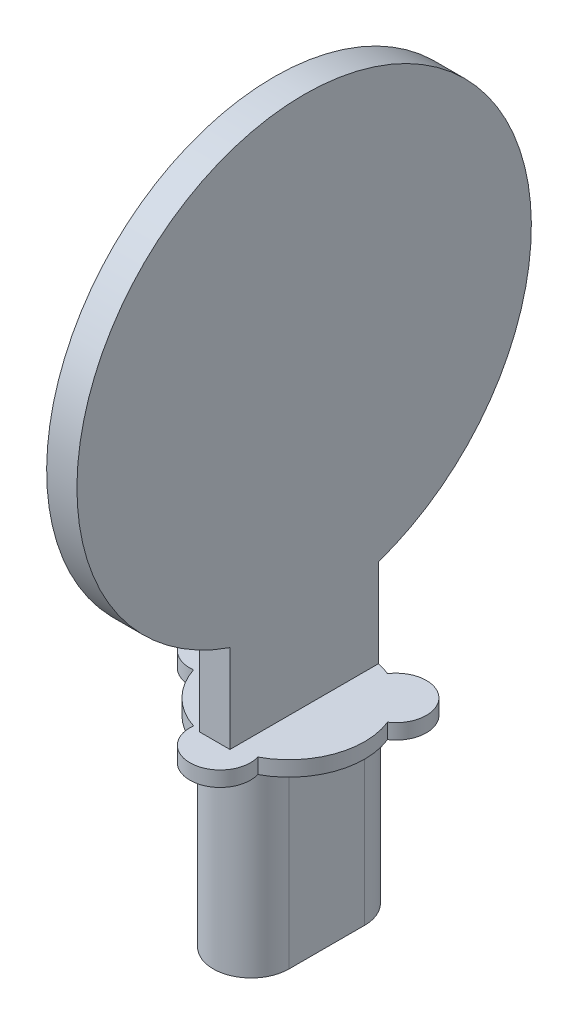
from build123d import *

# Parameters (mm, degrees)
BOSS_EXTRUDE1_DEPTH = 13
BOSS_EXTRUDE2_DEPTH = 1
SKETCH1_5_W         = 2
SKETCH1_5_H         = 9.797958972
BOSS_EXTRUDE3_DEPTH = 20
SKETCH2_R           = 15
BOSS_EXTRUDE4_DEPTH = 2


with BuildPart() as part:
    # Sketch1 → Boss-Extrude1 (new body)
    with BuildSketch(Plane(origin=(0, 0, 0), x_dir=(1, 0, 0), z_dir=(0, 1, 0))):
        with BuildLine():
            Line((2.5, 2.5), (2.5, -2.5))
            ThreePointArc((2.5, -2.5), (0, -5), (-2.5, -2.5))
            Line((-2.5, -2.5), (-2.5, 2.5))
            ThreePointArc((-2.5, 2.5), (0, 5), (2.5, 2.5))
        make_face()
    extrude(amount=-BOSS_EXTRUDE1_DEPTH)

    # Sketch1<3> → Boss-Extrude2 (add)
    with BuildSketch(Plane(origin=(0, 0, 0), x_dir=(1, 0, 0), z_dir=(0, 1, 0))):
        with BuildLine():
            ThreePointArc((1.867050547, 4.63833184), (-1.710100717, 4.698463104), (-4.411705933, 2.353051372))
            ThreePointArc((-4.411705933, 2.353051372), (-6.973362887, 0.610090199), (-4.75328529, -1.551218539))
            ThreePointArc((-4.75328529, -1.551218539), (-3.535533906, -3.535533906), (-1.551218539, -4.75328529))
            ThreePointArc((-1.551218539, -4.75328529), (0.610090199, -6.973362887), (2.353051372, -4.411705933))
            ThreePointArc((2.353051372, -4.411705933), (4.698463104, -1.710100717), (4.63833184, 1.867050547))
            ThreePointArc((4.63833184, 1.867050547), (4.949747468, 4.949747468), (1.867050547, 4.63833184))
        make_face()
    extrude(amount=-BOSS_EXTRUDE2_DEPTH)

    # Sketch1<5> → Boss-Extrude3 (add)
    with BuildSketch(Plane(origin=(0, 0, 0), x_dir=(1, 0, 0), z_dir=(0, 1, 0))):
        Rectangle(SKETCH1_5_W, SKETCH1_5_H)
    extrude(amount=BOSS_EXTRUDE3_DEPTH)

    # Sketch2 → Boss-Extrude4 (add)
    with BuildSketch(Plane.ZY.offset(1)):
        with Locations((0, 20)):
            Circle(SKETCH2_R)
    extrude(amount=-BOSS_EXTRUDE4_DEPTH)


solid = part.part
